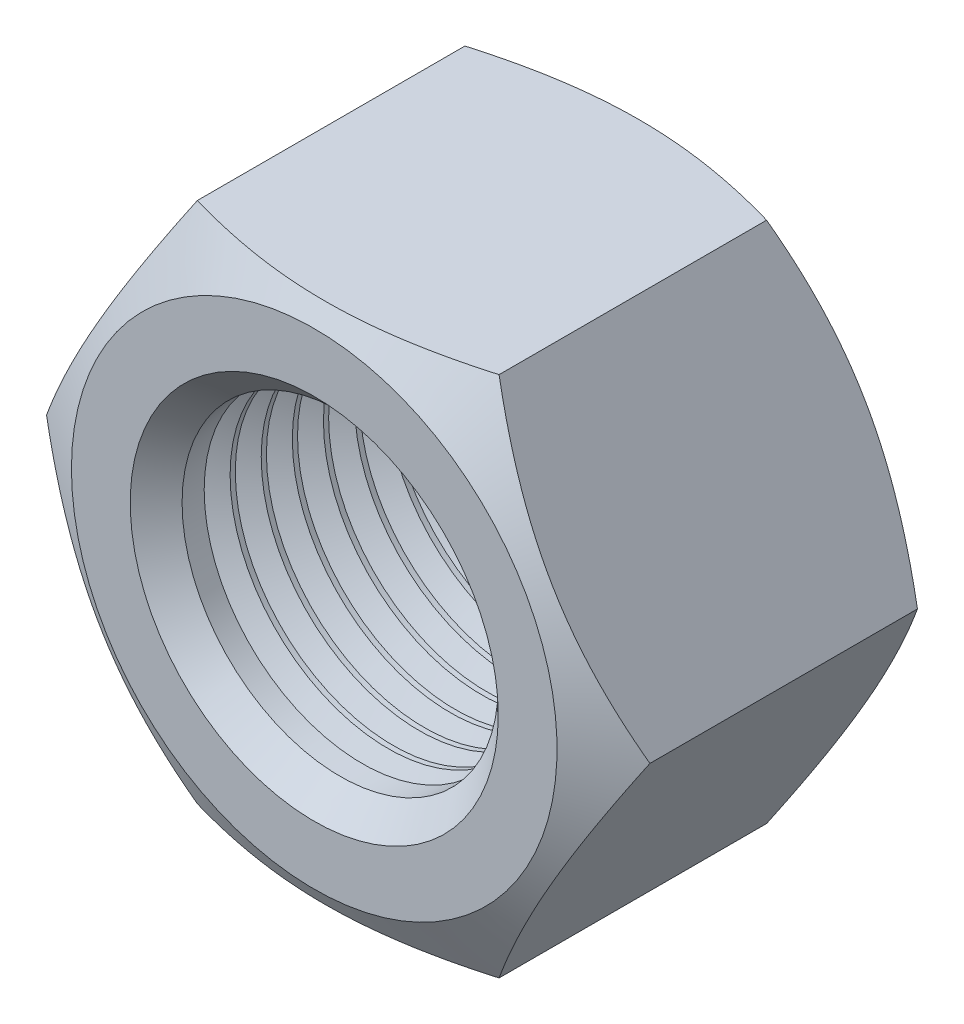
from build123d import *

# Parameters (mm, degrees)
SKETCH1_R        = 13.9175
BASENUT_DEPTH    = 28.6
ENDCHAMFER2_SIZE = 2.2825
LPATTERN10_COUNT = 9
LPATTERN10_PITCH = 2.739


with BuildPart() as part:
    # Sketch1 → BaseNut (new body)
    with BuildSketch(Plane.XY):
        Polygon((13.279056191, -23), (26.558112383, 0), (13.279056191, 23), (-13.279056191, 23), (-26.558112383, 0), (-13.279056191, -23), align=None)
        Circle(SKETCH1_R, mode=Mode.SUBTRACT)
    extrude(amount=-BASENUT_DEPTH)

    # Sketch2 → Chamfer1 (revolve, cut)
    with BuildSketch(Plane(origin=(15.04811501, 0, -16.706149795), x_dir=(0, 0, -1), z_dir=(0, 1, 0))):
        Polygon((9.839573063, 41.606227393), (11.893850205, 38.04811501), (11.893850205, 41.606227393), align=None)
    revolve(axis=Axis((0, 0, 7.016501752), (0, 0, -1)), mode=Mode.SUBTRACT)

    # Sketch6 → EndChamfer1 (revolve, cut)
    with BuildSketch(Plane(origin=(-9.197458863, 0, -10.252541137), x_dir=(0, 0, 1), z_dir=(0, 1, 0))):
        Polygon((-18.347458863, 23.114958863), (-18.347458863, 25.397458863), (-17.029656873, 23.114958863), align=None)
    revolve(axis=Axis((0, 0, 13.104863586), (0, 0, -1)), mode=Mode.SUBTRACT)

    # Sketch5 → Chamfer2 (revolve, cut)
    with BuildSketch(Plane(origin=(-14.793032735, 0, -16.96123207), x_dir=(0, 0, 1), z_dir=(0, 1, 0)), mode=Mode.PRIVATE) as chamfer2_sk:
        Polygon((16.96123207, 36.168032735), (16.96123207, 41.351145118), (13.968760741, 41.351145118), align=None)
    revolve(chamfer2_sk.sketch.rotate(Axis((0, 0, -39.536013381), (0, 0, 1)), 180), axis=Axis((0, 0, -39.536013381), (0, 0, 1)), mode=Mode.SUBTRACT)

    # EndChamfer2
    endchamfer2_edges = [part.edges().sort_by_distance(p)[0] for p in [
        (-13.9175, 0, 0),
    ]]
    chamfer(endchamfer2_edges, length=ENDCHAMFER2_SIZE)

    # Sketch7 → Cut-Revolve10 (revolve, cut)
    with BuildSketch(Plane(origin=(0, 0, 0), x_dir=(1, 0, 0), z_dir=(0, 1, 0))):
        Polygon((11.635, 28.423448011), (13.9175, 28.423448011), (15.894202984, 27.282198011), (13.9175, 26.140948011), (11.635, 26.140948011), align=None)
    cut_revolve10 = revolve(axis=Axis((0, 0, -48.618332322), (0, 0, 1)), mode=Mode.SUBTRACT)

    # LPattern10: Cut-Revolve10 ×9
    with Locations(*[(0, 0, i * LPATTERN10_PITCH) for i in range(1, LPATTERN10_COUNT)]):
        add(cut_revolve10, mode=Mode.SUBTRACT)


solid = part.part
